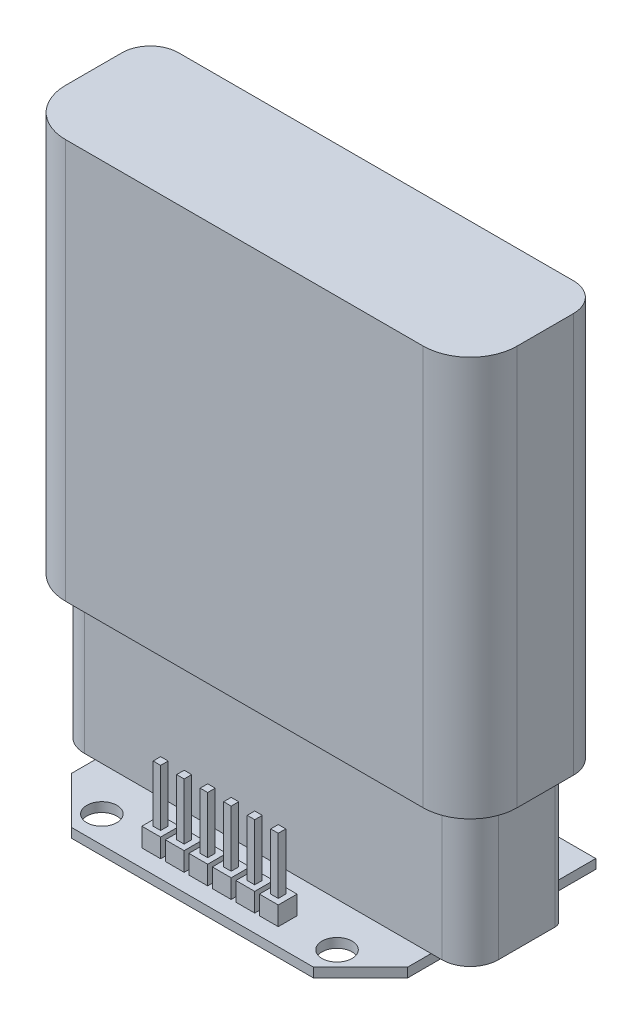
from build123d import *

# Parameters (mm, degrees)
SKETCH_1_W          = 35.7
SKETCH_1_H          = 25
EXTRUDE_1_DEPTH     = 1
SKETCH_2_W          = 48
SKETCH_2_H          = 14
EXTRUDE_2_DEPTH     = 57.5
FILLET_1_R          = 3
FILLET_2_R          = 5
CHAMFER_1_SIZE      = 5
HOLE_WIZARD_M3_1_D  = 3.2
CUT_EXTRUDE_START   = -15
CUT_EXTRUDE_1_DEPTH = 15
SKETCH_6_W          = 2
SKETCH_6_H          = 2
EXTRUDE_3_DEPTH     = 8
SKETCH_7_W          = 2
SKETCH_7_H          = 2
SKETCH_7_W_2        = 0.8
SKETCH_7_H_2        = 0.8
CUT_EXTRUDE_2_DEPTH = 6


with BuildPart() as part:
    # 草图1 → 凸台-拉伸1 (new body)
    with BuildSketch(Plane(origin=(0, 0, 0), x_dir=(1, 0, 0), z_dir=(0, 1, 0))):
        Rectangle(SKETCH_1_W, SKETCH_1_H)
    extrude(amount=EXTRUDE_1_DEPTH)

    # 草图2 → 凸台-拉伸2 (add)
    with BuildSketch(Plane(origin=(0, 1, 0), x_dir=(1, 0, 0), z_dir=(0, 1, 0))):
        Rectangle(SKETCH_2_W, SKETCH_2_H)
    extrude(amount=EXTRUDE_2_DEPTH)

    # 圆角1
    fillet_1_edges = [part.edges().sort_by_distance(p)[0] for p in [
        (-24, 29.75, -7),
        (24, 29.75, -7),
    ]]
    fillet(fillet_1_edges, radius=FILLET_1_R)

    # 圆角2
    fillet_2_edges = [part.edges().sort_by_distance(p)[0] for p in [
        (-24, 29.75, 7),
        (24, 29.75, 7),
    ]]
    fillet(fillet_2_edges, radius=FILLET_2_R)

    # 倒角1
    chamfer_1_edges = [part.edges().sort_by_distance(p)[0] for p in [
        (17.85, 0.5, 12.5),
        (-17.85, 0.5, 12.5),
    ]]
    chamfer(chamfer_1_edges, length=CHAMFER_1_SIZE)

    # M3 间隙孔1 (through all)
    with Locations(Plane(origin=(0, 0, 0), x_dir=(-1, 0, 0), z_dir=(0, -1, 0))):
        with Locations((0, 9.65), (-12.5, -9.65), (12.5, -9.65)):
            Hole(HOLE_WIZARD_M3_1_D / 2)

    # 草图5 → 切除-拉伸1 (cut)
    with BuildSketch(Plane.XZ.offset(-1).offset(CUT_EXTRUDE_START)):
        with BuildLine():
            Line((-24, 2), (-24, -4))
            ThreePointArc((-24, -4), (-23.121320344, -6.121320344), (-21, -7))
            Line((-21, -7), (21, -7))
            ThreePointArc((21, -7), (23.121320344, -6.121320344), (24, -4))
            Line((24, -4), (24, 2))
            ThreePointArc((24, 2), (22.535533906, 5.535533906), (19, 7))
            Line((19, 7), (-19, 7))
            ThreePointArc((-19, 7), (-22.535533906, 5.535533906), (-24, 2))
        make_face()
        with BuildLine():
            Line((-22, 2), (-22, -4))
            ThreePointArc((-22, -4), (-21.707106781, -4.707106781), (-21, -5))
            Line((-21, -5), (21, -5))
            ThreePointArc((21, -5), (21.707106781, -4.707106781), (22, -4))
            Line((22, -4), (22, 2))
            ThreePointArc((22, 2), (21.121320344, 4.121320344), (19, 5))
            Line((19, 5), (-19, 5))
            ThreePointArc((-19, 5), (-21.121320344, 4.121320344), (-22, 2))
        make_face(mode=Mode.SUBTRACT)
    extrude(amount=CUT_EXTRUDE_1_DEPTH, mode=Mode.SUBTRACT)

    # 草图6 → 凸台-拉伸3 (add)
    with BuildSketch(Plane(origin=(0, 1, 0), x_dir=(1, 0, 0), z_dir=(0, 1, 0))):
        with Locations((1.25, -9.65)):
            Rectangle(SKETCH_6_W, SKETCH_6_H)
        with Locations((-1.25, -9.65)):
            Rectangle(SKETCH_6_W, SKETCH_6_H)
        with Locations((-3.75, -9.65)):
            Rectangle(SKETCH_6_W, SKETCH_6_H)
        with Locations((-6.25, -9.65)):
            Rectangle(SKETCH_6_W, SKETCH_6_H)
        with Locations((6.25, -9.65)):
            Rectangle(SKETCH_6_W, SKETCH_6_H)
        with Locations((3.75, -9.65)):
            Rectangle(SKETCH_6_W, SKETCH_6_H)
    extrude(amount=EXTRUDE_3_DEPTH)

    # 草图7 → 切除-拉伸2 (cut)
    # profile 1 of 6: a face of its own
    with BuildSketch(Plane(origin=(0, 9, 0), x_dir=(1, 0, 0), z_dir=(0, 1, 0))):
        with Locations((-6.25, -9.65)):
            Rectangle(SKETCH_7_W, SKETCH_7_H)
        with Locations((-6.25, -9.65)):
            Rectangle(SKETCH_7_W_2, SKETCH_7_H_2, mode=Mode.SUBTRACT)
    # profile 2 of 6: a face of its own
    with BuildSketch(Plane(origin=(0, 9, 0), x_dir=(1, 0, 0), z_dir=(0, 1, 0))):
        with Locations((6.25, -9.65)):
            Rectangle(SKETCH_7_W, SKETCH_7_H)
        with Locations((6.25, -9.65)):
            Rectangle(SKETCH_7_W_2, SKETCH_7_H_2, mode=Mode.SUBTRACT)
    # profile 3 of 6: a face of its own
    with BuildSketch(Plane(origin=(0, 9, 0), x_dir=(1, 0, 0), z_dir=(0, 1, 0))):
        with Locations((3.75, -9.65)):
            Rectangle(SKETCH_7_W, SKETCH_7_H)
        with Locations((3.75, -9.65)):
            Rectangle(SKETCH_7_W_2, SKETCH_7_H_2, mode=Mode.SUBTRACT)
    # profile 4 of 6: a face of its own
    with BuildSketch(Plane(origin=(0, 9, 0), x_dir=(1, 0, 0), z_dir=(0, 1, 0))):
        with Locations((1.25, -9.65)):
            Rectangle(SKETCH_7_W, SKETCH_7_H)
        with Locations((1.25, -9.65)):
            Rectangle(SKETCH_7_W_2, SKETCH_7_H_2, mode=Mode.SUBTRACT)
    # profile 5 of 6: a face of its own
    with BuildSketch(Plane(origin=(0, 9, 0), x_dir=(1, 0, 0), z_dir=(0, 1, 0))):
        with Locations((-1.25, -9.65)):
            Rectangle(SKETCH_7_W, SKETCH_7_H)
        with Locations((-1.25, -9.65)):
            Rectangle(SKETCH_7_W_2, SKETCH_7_H_2, mode=Mode.SUBTRACT)
    # profile 6 of 6: a face of its own
    with BuildSketch(Plane(origin=(0, 9, 0), x_dir=(1, 0, 0), z_dir=(0, 1, 0))):
        with Locations((-3.75, -9.65)):
            Rectangle(SKETCH_7_W, SKETCH_7_H)
        with Locations((-3.75, -9.65)):
            Rectangle(SKETCH_7_W_2, SKETCH_7_H_2, mode=Mode.SUBTRACT)
    extrude(amount=-CUT_EXTRUDE_2_DEPTH, mode=Mode.SUBTRACT)


solid = part.part
